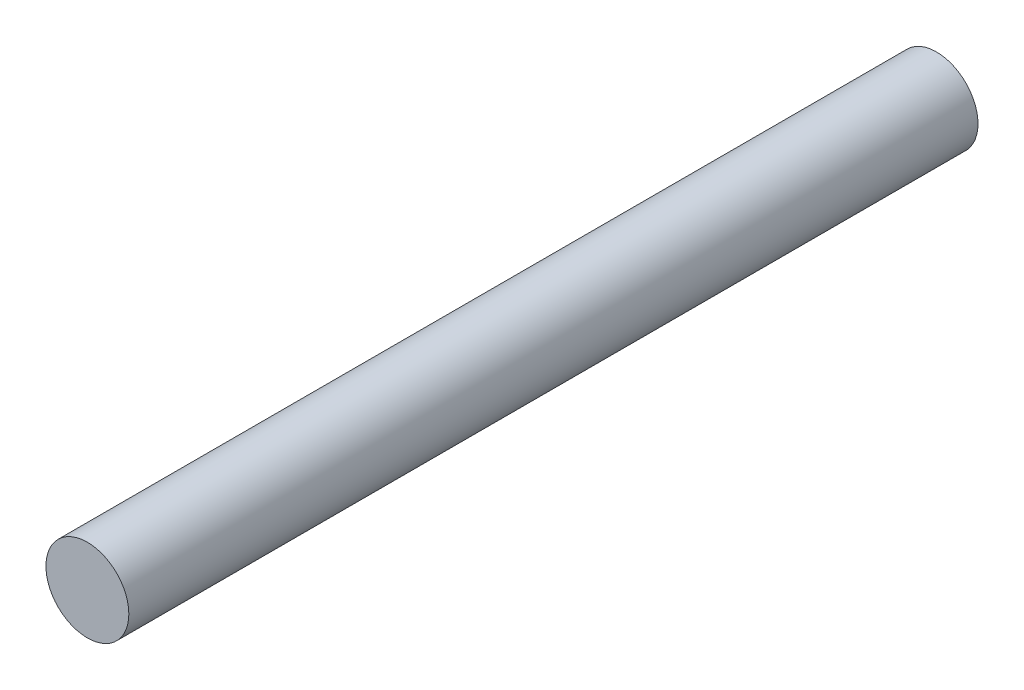
from build123d import *

# Parameters (mm, degrees)
BOSS_EXTRUDE1_DEPTH      = 60
BOSS_EXTRUDE1_DEPTH_BACK = 33
SKETCH1_R                = 4.54


with BuildPart() as part:
    # Sketch1 → Boss-Extrude1 (new, two sides: drawn at the far end of the back side and taken through both)
    with BuildSketch(Plane.XY.offset(-BOSS_EXTRUDE1_DEPTH_BACK)):
        Circle(SKETCH1_R)
    extrude(amount=BOSS_EXTRUDE1_DEPTH + BOSS_EXTRUDE1_DEPTH_BACK)


solid = part.part
